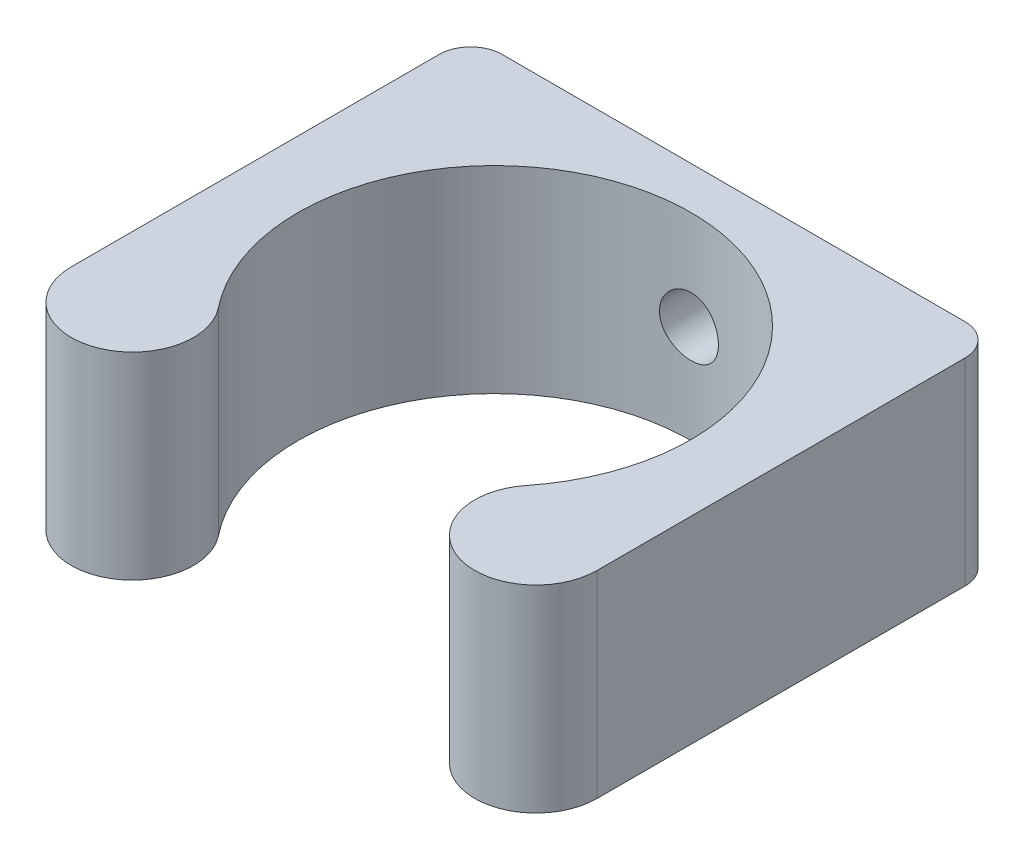
from build123d import *

# Parameters (mm, degrees)
BOSS_EXTRUDE1_DEPTH = 15.9512
FILLET1_R           = 2.54
SKETCH3_R           = 2.38125
CUT_EXTRUDE1_DEPTH  = 60.67865116


with BuildPart() as part:
    # Sketch2 → Boss-Extrude1 (new body)
    with BuildSketch(Plane(origin=(0, 0, 0), x_dir=(1, 0, 0), z_dir=(0, 1, 0))):
        with BuildLine():
            Line((-43.856127716, 39.498822447), (-43.856127716, 7.240822447))
            ThreePointArc((-43.856127716, 7.240822447), (-37.287152217, 2.576192047), (-35.048092212, 10.315496032))
            ThreePointArc((-35.048092212, 10.315496032), (-36.919453616, 27.093420789), (-22.621727716, 36.069822447))
            Line((-22.621727716, 36.069822447), (-22.621727716, 39.498822447))
            Line((-22.621727716, 39.498822447), (-43.856127716, 39.498822447))
        make_face()
        with BuildLine():
            Line((-1.387327716, 39.498822447), (-22.621727716, 39.498822447))
            Line((-22.621727716, 39.498822447), (-22.621727716, 36.069822447))
            ThreePointArc((-22.621727716, 36.069822447), (-8.324001816, 27.093420789), (-10.19536322, 10.315496032))
            ThreePointArc((-10.19536322, 10.315496032), (-7.956303215, 2.576192047), (-1.387327716, 7.240822447))
            Line((-1.387327716, 7.240822447), (-1.387327716, 39.498822447))
        make_face()
    extrude(amount=BOSS_EXTRUDE1_DEPTH)

    # Fillet1
    fillet1_edges = [part.edges().sort_by_distance(p)[0] for p in [
        (-43.856127716, 7.9756, -39.498822447),
        (-1.387327716, 7.9756, -39.498822447),
    ]]
    fillet(fillet1_edges, radius=FILLET1_R)

    # Sketch3 → Cut-Extrude1 (cut, through all)
    with BuildSketch(Plane(origin=(0, 0, -39.498822447), x_dir=(-1, 0, 0), z_dir=(0, 0, -1))):
        with Locations((22.621727716, 7.9756)):
            Circle(SKETCH3_R)
    extrude(amount=-CUT_EXTRUDE1_DEPTH, mode=Mode.SUBTRACT)


solid = part.part
